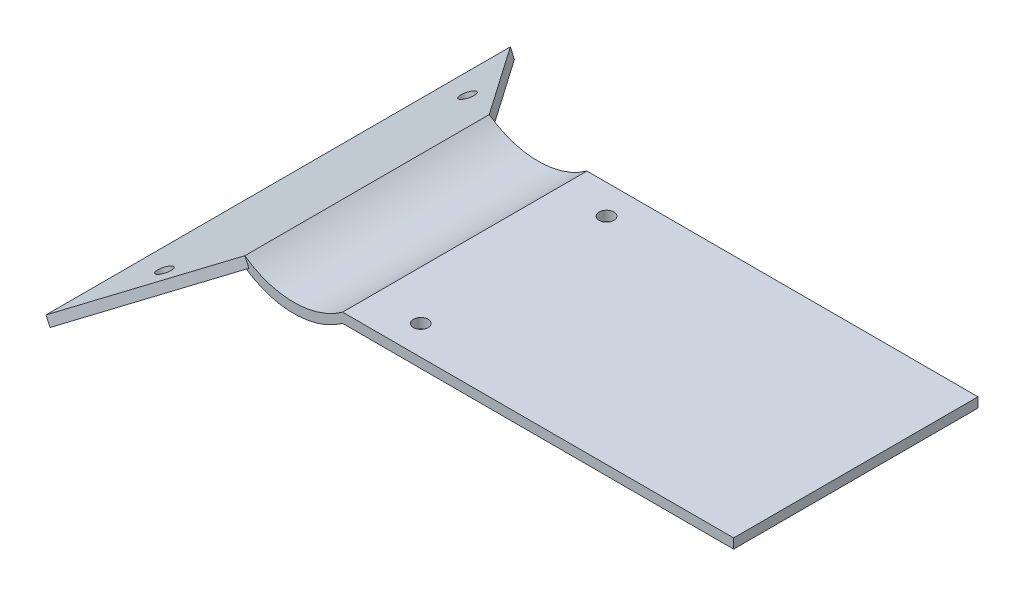
from build123d import *

# Parameters (mm, degrees)
SKETCH_1_W          = 800
SKETCH_1_H          = 20
EXTRUDE_1_DEPTH     = 500
SKETCH_3_R          = 15
EXTRUDE_2_DEPTH     = 20
SKETCH_5_R          = 15
CUT_EXTRUDE_1_DEPTH = 1100.74273844


with BuildPart() as part:
    # 草图1 → 凸台-拉伸1 (new body)
    with BuildSketch(Plane.XY):
        Rectangle(SKETCH_1_W, SKETCH_1_H)
        with BuildLine():
            ThreePointArc((-600, 10), (-500, -22.522729151), (-400, 10))
            Line((-400, 10), (-400, -10))
            ThreePointArc((-400, -10), (-500, -42.522729151), (-600, -10))
            Line((-600, -10), (-600, 10))
        make_face()
        Polygon((-600, 10), (-781.811868577, -73.333333333), (-818.174242293, -110), (-600, -10), align=None)
    extrude(amount=EXTRUDE_1_DEPTH)

    # 草图3 → 凸台-拉伸2 (add)
    # profile 1 of 2: a face of its own
    with BuildSketch(Plane(origin=(-107.954413929, 235.52872461, 0), x_dir=(0.9090593428863094, 0.41666666666666713, 0), z_dir=(-0.41666666666666713, 0.9090593428863094, 0))):
        Polygon((-741.268939065, 0), (-541.268939065, 0), (-741.268939065, 225), align=None)
        with Locations(Location((-656.268939065, 60, 0), (0, 0, 180))):
            Circle(SKETCH_3_R, mode=Mode.SUBTRACT)
    # profile 2 of 2: a face of its own
    with BuildSketch(Plane(origin=(-107.954413929, 235.52872461, 0), x_dir=(0.9090593428863094, 0.41666666666666713, 0), z_dir=(-0.41666666666666713, 0.9090593428863094, 0))):
        Polygon((-741.268939065, -725), (-541.268939065, -500), (-741.268939065, -500), align=None)
        with Locations(Location((-656.268939065, -560, 0), (0, 0, 180))):
            Circle(SKETCH_3_R, mode=Mode.SUBTRACT)
    extrude(amount=-EXTRUDE_2_DEPTH)

    # 草图5 → 切除-拉伸1 (cut, through all)
    with BuildSketch(Plane(origin=(0, 10, 0), x_dir=(1, 0, 0), z_dir=(0, 1, 0))):
        with Locations(Location((-300, -60, 0), (0, 0, 180))):
            Circle(SKETCH_5_R)
        with Locations(Location((-300, -440, 0), (0, 0, 180))):
            Circle(SKETCH_5_R)
    extrude(amount=-CUT_EXTRUDE_1_DEPTH, mode=Mode.SUBTRACT)


solid = part.part
